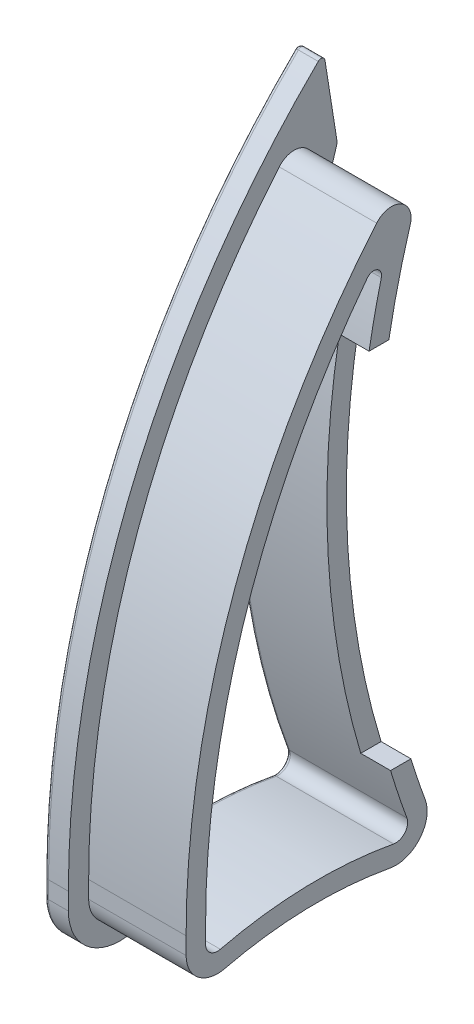
from build123d import *

# Parameters (mm, degrees)
BOSS_EXTRUDE1_DEPTH = 1.524
CUT_EXTRUDE1_DEPTH  = 1.524
FILLET1_R           = 0.508
BOSS_EXTRUDE2_DEPTH = 6.223
BOSS_EXTRUDE3_START = -1.524
BOSS_EXTRUDE3_DEPTH = 1.524
CUT_EXTRUDE2_START  = -6.223
CUT_EXTRUDE2_DEPTH  = 6.223
FILLET2_R           = 0.254
SKETCH9_W           = 1.905
SKETCH9_H           = 23.876
CUT_EXTRUDE4_DEPTH  = 51.542276073
FILLET3_R           = 0.254


with BuildPart() as part:
    # Sketch2 → Boss-Extrude1 (new body)
    with BuildSketch(Plane(origin=(0, 0, 0), x_dir=(0, 0, -1), z_dir=(1, 0, 0))):
        with BuildLine():
            Line((-10.16, 10.851579944), (-10.16, 9.756379827))
            ThreePointArc((-10.16, 9.756379827), (-8.902698353, 7.16361824), (-6.088278228, 6.54534691))
            ThreePointArc((-6.088278228, 6.54534691), (-1.097578785, 7.201770952), (3.920718614, 6.808496661))
            ThreePointArc((3.920718614, 6.808496661), (7.044965017, 7.926917254), (7.619757818, 11.195157369))
            ThreePointArc((7.619757818, 11.195157369), (4.593793799, 26.843864795), (6.687175028, 42.644379261))
            ThreePointArc((6.687175028, 42.644379261), (5.465660141, 45.611386582), (2.312998216, 45.014767901))
            ThreePointArc((2.312998216, 45.014767901), (-6.944233805, 29.036045126), (-10.16, 10.851579944))
        make_face()
    extrude(amount=BOSS_EXTRUDE1_DEPTH)

    # Sketch3 → Cut-Extrude1 (cut)
    with BuildSketch(Plane(origin=(1.524, 0, 0), x_dir=(0, 0, -1), z_dir=(1, 0, 0))):
        with BuildLine():
            Line((-7.62, 10.851579944), (-7.62, 9.756379827))
            ThreePointArc((-7.62, 9.756379827), (-7.329853466, 9.15805023), (-6.680371899, 9.015372231))
            ThreePointArc((-6.680371899, 9.015372231), (-1.164335672, 9.74089354), (4.382203558, 9.306221955))
            ThreePointArc((4.382203558, 9.306221955), (5.103183497, 9.564319015), (5.23582799, 10.318528273))
            ThreePointArc((5.23582799, 10.318528273), (2.05490982, 26.768577734), (4.25548932, 43.378207999))
            ThreePointArc((4.25548932, 43.378207999), (-4.558282485, 28.164933022), (-7.62, 10.851579944))
        make_face()
    extrude(amount=-CUT_EXTRUDE1_DEPTH, mode=Mode.SUBTRACT)

    # Fillet1
    fillet1_edges = [part.edges().sort_by_distance(p)[0] for p in [
        (0.762, 43.378207999, -4.25548932),
    ]]
    fillet(fillet1_edges, radius=FILLET1_R)

    # Sketch4 → Boss-Extrude2 (add)
    with BuildSketch(Plane.ZY):
        with BuildLine():
            Line((8.89, 9.756379827), (8.89, 10.851579944))
            ThreePointArc((8.89, 10.851579944), (5.751258145, 28.600489074), (-3.284243768, 44.19648795))
            ThreePointArc((-3.284243768, 44.19648795), (-4.86057473, 44.49479729), (-5.471332174, 43.01129363))
            ThreePointArc((-5.471332174, 43.01129363), (-3.32435181, 26.806221264), (-6.427792904, 10.756842821))
            ThreePointArc((-6.427792904, 10.756842821), (-6.074074257, 8.745618135), (-4.151461086, 8.057359308))
            ThreePointArc((-4.151461086, 8.057359308), (1.130957229, 8.471332246), (6.384325063, 7.78035957))
            ThreePointArc((6.384325063, 7.78035957), (8.116275909, 8.160834235), (8.89, 9.756379827))
        make_face()
        with BuildLine():
            Line((7.62, 9.756379827), (7.62, 10.851579944))
            ThreePointArc((7.62, 10.851579944), (4.96917921, 26.995100943), (-2.704895567, 41.443239142))
            ThreePointArc((-2.704895567, 41.443239142), (-3.329273356, 41.593156599), (-3.601704042, 41.011689155))
            ThreePointArc((-3.601704042, 41.011689155), (-2.10574247, 25.541961828), (-5.23582799, 10.318528273))
            ThreePointArc((-5.23582799, 10.318528273), (-5.103183497, 9.564319015), (-4.382203558, 9.306221955))
            ThreePointArc((-4.382203558, 9.306221955), (1.164335672, 9.74089354), (6.680371899, 9.015372231))
            ThreePointArc((6.680371899, 9.015372231), (7.329853466, 9.15805023), (7.62, 9.756379827))
        make_face(mode=Mode.SUBTRACT)
    extrude(amount=BOSS_EXTRUDE2_DEPTH)

    # Sketch5 → Boss-Extrude3 (add)
    with BuildSketch(Plane(origin=(1.524, 0, 0), x_dir=(0, 0, -1), z_dir=(1, 0, 0)).offset(BOSS_EXTRUDE3_START)):
        with BuildLine():
            Line((7.009110806, 43.67080126), (6.148171078, 49.106560771))
            ThreePointArc((6.148171078, 49.106560771), (3.588810081, 46.474083877), (1.217761815, 43.67080126))
            Line((1.217761815, 43.67080126), (6.534669415, 42.12894069))
            ThreePointArc((6.534669415, 42.12894069), (6.765621389, 42.901799905), (7.009110806, 43.67080126))
        make_face()
    extrude(amount=BOSS_EXTRUDE3_DEPTH)

    # Sketch6 → Cut-Extrude2 (cut)
    with BuildSketch(Plane.ZY.offset(6.223).offset(CUT_EXTRUDE2_START)):
        with BuildLine():
            Line((8.89, 9.756379827), (8.89, 10.851579944))
            ThreePointArc((8.89, 10.851579944), (5.751258145, 28.600489074), (-3.284243768, 44.19648795))
            ThreePointArc((-3.284243768, 44.19648795), (-4.86057473, 44.49479729), (-5.471332174, 43.01129363))
            ThreePointArc((-5.471332174, 43.01129363), (-3.32435181, 26.806221264), (-6.427792904, 10.756842821))
            ThreePointArc((-6.427792904, 10.756842821), (-6.074074257, 8.745618135), (-4.151461086, 8.057359308))
            ThreePointArc((-4.151461086, 8.057359308), (1.130957229, 8.471332246), (6.384325063, 7.78035957))
            ThreePointArc((6.384325063, 7.78035957), (8.116275909, 8.160834235), (8.89, 9.756379827))
        make_face()
        with BuildLine():
            Line((8.8646, 9.756379827), (8.8646, 10.851579944))
            ThreePointArc((8.8646, 10.851579944), (5.727398631, 28.591777953), (-3.303668679, 44.180122351))
            ThreePointArc((-3.303668679, 44.180122351), (-4.848473022, 44.472465504), (-5.447015317, 43.018631917))
            ThreePointArc((-5.447015317, 43.018631917), (-3.29896297, 26.805468394), (-6.403953606, 10.74807653))
            ThreePointArc((-6.403953606, 10.74807653), (-6.054656442, 8.761992152), (-4.156075935, 8.082336561))
            ThreePointArc((-4.156075935, 8.082336561), (1.131624798, 8.496723472), (6.390246, 7.805059824))
            ThreePointArc((6.390246, 7.805059824), (8.100547461, 8.180778555), (8.8646, 9.756379827))
        make_face(mode=Mode.SUBTRACT)
    extrude(amount=CUT_EXTRUDE2_DEPTH, mode=Mode.SUBTRACT)

    # Fillet2
    fillet2_edges = [part.edges().sort_by_distance(p)[0] for p in [
        (0.762, 49.106560771, -6.148171078),
    ]]
    fillet(fillet2_edges, radius=FILLET2_R)

    # Sketch9 → Cut-Extrude4 (cut, through all)
    with BuildSketch(Plane.XY.offset(-1.27)):
        with Locations((-5.2705, 25.4)):
            Rectangle(SKETCH9_W, SKETCH9_H)
    extrude(amount=-CUT_EXTRUDE4_DEPTH, mode=Mode.SUBTRACT)

    # Fillet3
    fillet3_edges = [part.edges().sort_by_distance(p)[0] for p in [
        (1.524, 10.303979886, 10.16),
        (1.524, 31.419004876, 6.008417097),
        (1.524, 48.825128825, -6.053623792),
        (1.524, 7.16361824, 8.902698353),
        (1.524, 7.201770952, 1.097578785),
        (1.524, 7.926917254, -7.044965017),
        (1.524, 10.303979886, 7.62),
        (1.524, 9.15805023, 7.329853466),
        (1.524, 9.74089354, 1.164335672),
        (1.524, 9.564319015, -5.103183497),
        (1.524, 25.541961828, -2.10574247),
        (1.524, 27.381577524, -4.580766254),
        (1.524, 26.995100943, 4.96917921),
        (1.524, 41.593156599, -3.329273357),
        (1.524, 46.147271822, -6.616876402),
    ]]
    fillet(fillet3_edges, radius=FILLET3_R)


with BuildPart() as body_2:
    # Mirror2: mirrored copy
    add(part.part.mirror(Plane(origin=(-6.223, 10.851579944, -42.8625), x_dir=(0, 0, 1), z_dir=(-1, 0, 0))))


solid = body_2.part
